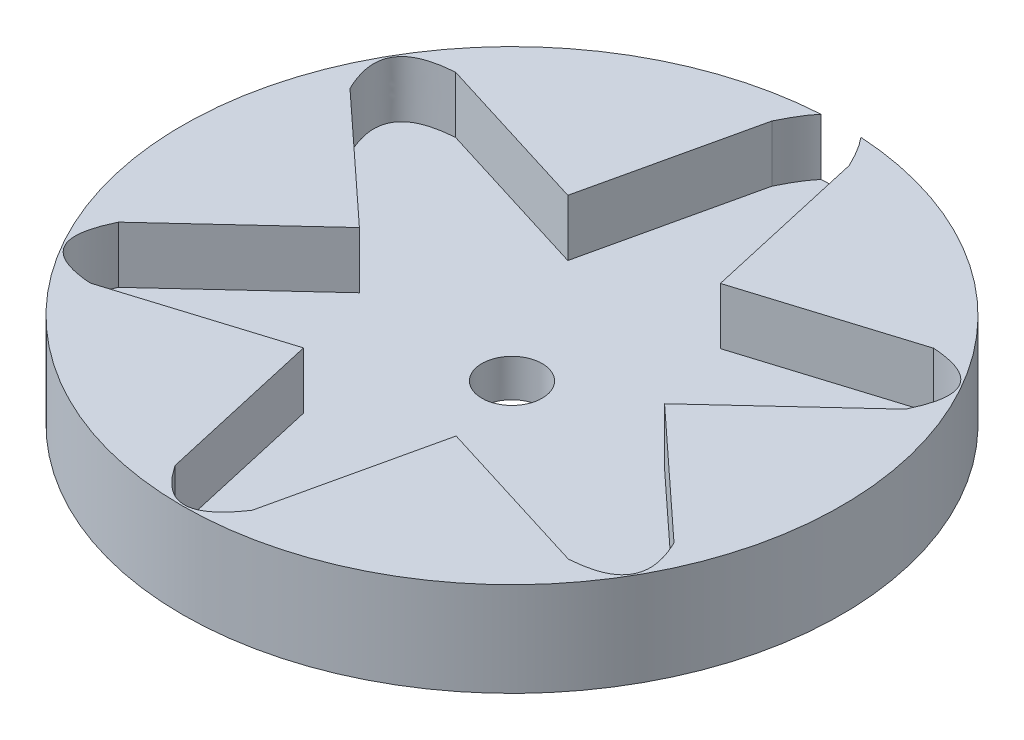
from build123d import *

# Parameters (mm, degrees)
SKETCH1_R           = 17.5
BOSS_EXTRUDE1_DEPTH = 10
CUT_EXTRUDE2_DEPTH  = 3
SKETCH4_R           = 17.5
CUT_EXTRUDE3_DEPTH  = 5
SKETCH5_R           = 1.6
CUT_EXTRUDE4_DEPTH  = 5


with BuildPart() as part:
    # Sketch1 → Boss-Extrude1 (new body)
    with BuildSketch(Plane(origin=(0, 0, 0), x_dir=(1, 0, 0), z_dir=(0, 1, 0))):
        with Locations(Location((0, 0, 0), (0, 0, 270))):
            Circle(SKETCH1_R)
    extrude(amount=BOSS_EXTRUDE1_DEPTH)

    # Sketch3 → Cut-Extrude2 (cut)
    with BuildSketch(Plane(origin=(-674.936170281, 10, -1288.963286539), x_dir=(1, 0, 0), z_dir=(0, 1, 0))):
        with BuildLine():
            Line((670.88481746, -1281.946137613), (662.239438243, -1279.26312032))
            add(Edge.make_bspline(
                [(662.239438243, -1279.26312032), (660.816630975, -1279.364358211), (659.786645841, -1280.216704525), (659.563484847, -1281.534870974), (660.187213896, -1282.817677158)],
                knots=[0.002399099, 0.002399099, 0.002399099, 0.375599775, 0.624400225, 0.997600901, 0.997600901, 0.997600901], degree=2))
            Line((660.187213896, -1282.817677158), (666.833464638, -1288.963286539))
            Line((666.833464638, -1288.963286539), (660.187213896, -1295.108895919))
            add(Edge.make_bspline(
                [(660.187213896, -1295.108895919), (659.563484847, -1296.391702103), (659.786645841, -1297.709868552), (660.816630975, -1298.562214867), (662.239438243, -1298.663452757)],
                knots=[0.002399099, 0.002399099, 0.002399099, 0.375599775, 0.624400225, 0.997600901, 0.997600901, 0.997600901], degree=2))
            Line((662.239438243, -1298.663452757), (670.88481746, -1295.980435464))
            Line((670.88481746, -1295.980435464), (672.883945934, -1304.809062138))
            add(Edge.make_bspline(
                [(672.883945934, -1304.809062138), (673.683024153, -1305.990630431), (674.936170281, -1306.456450565), (676.189316409, -1305.990630431), (676.988394628, -1304.809062138)],
                knots=[0.002399099, 0.002399099, 0.002399099, 0.375599775, 0.624400225, 0.997600901, 0.997600901, 0.997600901], degree=2))
            Line((676.988394628, -1304.809062138), (678.987523102, -1295.980435464))
            Line((678.987523102, -1295.980435464), (687.632902319, -1298.663452757))
            add(Edge.make_bspline(
                [(687.632902319, -1298.663452757), (689.055709587, -1298.562214867), (690.085694721, -1297.709868552), (690.308855715, -1296.391702103), (689.685126666, -1295.108895919)],
                knots=[0.002399099, 0.002399099, 0.002399099, 0.375599775, 0.624400225, 0.997600901, 0.997600901, 0.997600901], degree=2))
            Line((689.685126666, -1295.108895919), (683.038875923, -1288.963286539))
            Line((683.038875923, -1288.963286539), (689.685126666, -1282.817677158))
            add(Edge.make_bspline(
                [(689.685126666, -1282.817677158), (690.308855715, -1281.534870974), (690.08569472, -1280.216704525), (689.055709587, -1279.364358211), (687.632902319, -1279.26312032)],
                knots=[0.002399099, 0.002399099, 0.002399099, 0.375599775, 0.624400225, 0.997600901, 0.997600901, 0.997600901], degree=2))
            Line((687.632902319, -1279.26312032), (678.987523102, -1281.946137613))
            Line((678.987523102, -1281.946137613), (676.986708426, -1273.110064271))
            add(Edge.make_bspline(
                [(676.986708426, -1273.110064271), (676.173308063, -1271.410983092), (674.936170281, -1270.754606381), (673.699032499, -1271.410983092), (672.885632136, -1273.110064271)],
                knots=[0.001074269, 0.001074269, 0.001074269, 0.375268567, 0.624731433, 0.998925731, 0.998925731, 0.998925731], degree=2))
            Line((672.885632136, -1273.110064271), (670.88481746, -1281.946137613))
        make_face()
    extrude(amount=-CUT_EXTRUDE2_DEPTH, mode=Mode.SUBTRACT)

    # Sketch4 → Cut-Extrude3 (cut)
    with BuildSketch(Plane.XZ):
        with Locations(Location((0, 0, 0), (0, 0, 270))):
            Circle(SKETCH4_R)
    extrude(amount=-CUT_EXTRUDE3_DEPTH, mode=Mode.SUBTRACT)

    # Sketch5 → Cut-Extrude4 (cut)
    with BuildSketch(Plane(origin=(0, 7, 0), x_dir=(1, 0, 0), z_dir=(0, 1, 0))):
        with Locations(Location((0, 0, 0), (0, 0, 270))):
            Circle(SKETCH5_R)
    extrude(amount=-CUT_EXTRUDE4_DEPTH, mode=Mode.SUBTRACT)


solid = part.part
